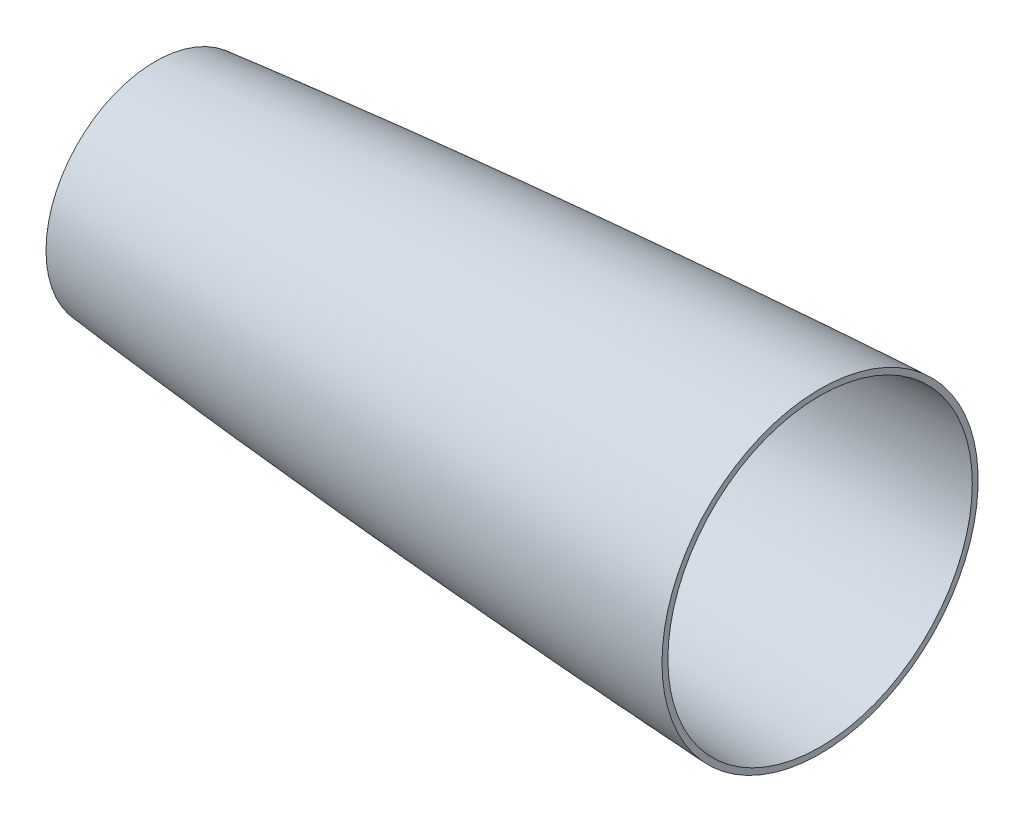
from build123d import *

# Parameters (mm, degrees)
SHELL3_T           = -1.64
SKETCH2_R          = 29.110601934
CUT_EXTRUDE1_DEPTH = 10


with BuildPart() as part:
    # Sketch1 → Revolve2 (revolve)
    with BuildSketch(Plane(origin=(0, 0, 0), x_dir=(1, 0, 0), z_dir=(0, 1, 0))):
        with BuildLine():
            Line((186.199993601, 30.594163564), (186.199993601, 0))
            Line((186.199993601, 0), (372.3999936, 0))
            Line((372.3999936, 0), (372.3999936, 44.273302763))
            add(Edge.make_bspline(
                [(186.199993601, 30.594163564), (186.8476588, 30.659415977), (188.168070473, 30.79188334), (191.91883936, 31.16640144), (196.124448635, 31.578407394), (201.840880216, 32.131144857), (207.893679348, 32.70167564), (214.205416019, 33.285777449), (220.368425407, 33.842636368), (226.62220161, 34.39660876), (232.822774931, 34.933428075), (239.057194674, 35.462048722), (245.272680031, 35.977392449), (251.501013914, 36.482781559), (259.127235962, 37.088005816), (268.317681549, 37.796558755), (279.05898417, 38.594812009), (289.813463409, 39.358791364), (299.150130156, 39.997076933), (306.950403049, 40.513511803), (313.159713414, 40.915320585), (319.432370013, 41.310617298), (325.595017121, 41.690852767), (331.944862255, 42.070922698), (337.985384405, 42.426203271), (344.538040115, 42.797655646), (350.247962448, 43.117946037), (357.349401431, 43.498316293), (362.148151185, 43.755033629), (368.611062849, 44.083299339), (371.099714053, 44.208608011), (372.3999936, 44.273302763)],
                knots=[0.082776805, 0.082776805, 0.082776805, 0.082776805, 0.082776805, 0.096721516, 0.110666227, 0.138555648, 0.166445069, 0.19433449, 0.222223911, 0.250113332, 0.278002753, 0.305892174, 0.333781595, 0.361671016, 0.389560438, 0.417449858, 0.470511269, 0.526290111, 0.582068953, 0.609958374, 0.637847796, 0.665737217, 0.693626638, 0.721516059, 0.74940548, 0.777294901, 0.805184322, 0.833073743, 0.860963164, 0.888852585, 0.916742006, 0.916742006, 0.916742006, 0.916742006, 0.916742006], degree=4))
        make_face()
    revolve(axis=Axis((186.199993601, 0, 0), (1, 0, 0)))

    # Shell3
    shell3_openings = [part.faces().sort_by_distance(p)[0] for p in [
        (372.3999936, 0, 0),
    ]]
    offset(amount=SHELL3_T, openings=shell3_openings, kind=Kind.INTERSECTION)

    # Sketch2 → Cut-Extrude1 (cut)
    with BuildSketch(Plane(origin=(187.839993601, 0, 0), x_dir=(0, 0, -1), z_dir=(1, 0, 0))):
        Circle(SKETCH2_R)
    extrude(amount=-CUT_EXTRUDE1_DEPTH, mode=Mode.SUBTRACT)


solid = part.part
